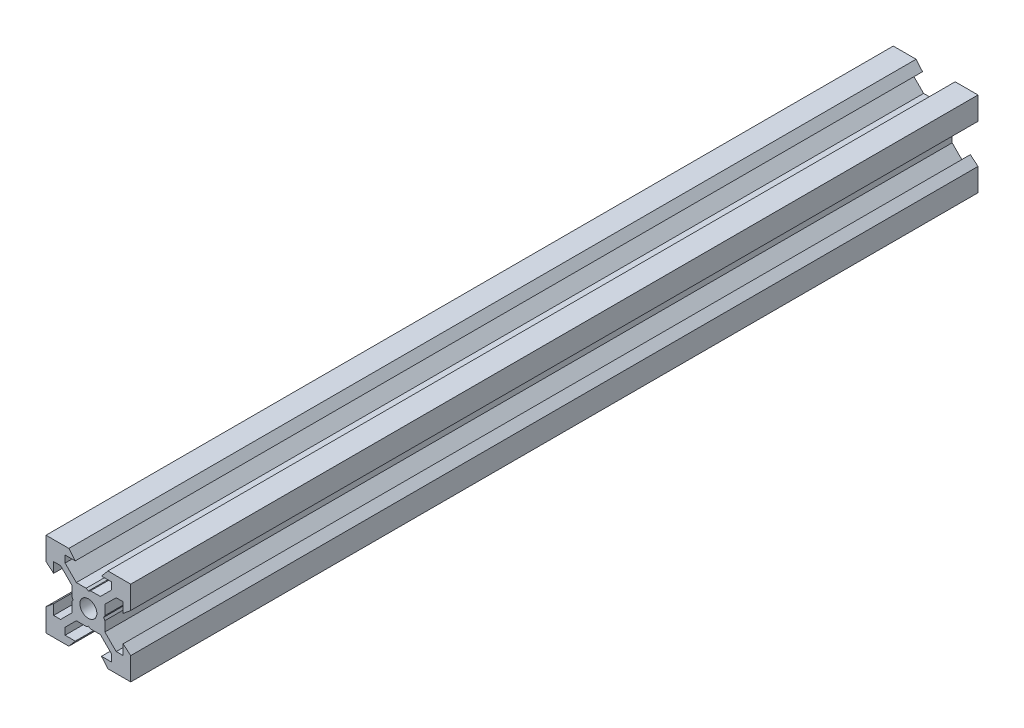
from build123d import *

# Parameters (mm, degrees)
SKETCH1_R           = 2
BOSS_EXTRUDE1_DEPTH = 100


with BuildPart() as part:
    # Sketch1 → Boss-Extrude1 (new, symmetric)
    with BuildSketch(Plane.XY):
        Polygon((10, 10), (10, 4.610379336), (8.2, 3.1), (8.2, 5.5), (6.560660172, 5.5), (3.9, 2.839339828), (3.9, 0.519615242), (3.6, 0), (3.9, -0.519615242), (3.9, -2.839339828), (6.560660172, -5.5), (8.2, -5.5), (8.2, -3.1), (10, -4.610379336), (10, -10), (4.610379336, -10), (3.1, -8.2), (5.5, -8.2), (5.5, -6.560660172), (2.839339828, -3.9), (0.519615242, -3.9), (0, -3.6), (-0.519615242, -3.9), (-2.839339828, -3.9), (-5.5, -6.560660172), (-5.5, -8.2), (-3.1, -8.2), (-4.610379336, -10), (-10, -10), (-10, -4.610379336), (-8.2, -3.1), (-8.2, -5.5), (-6.560660172, -5.5), (-3.9, -2.839339828), (-3.9, -0.519615242), (-3.6, 0), (-3.9, 0.519615242), (-3.9, 2.839339828), (-6.560660172, 5.5), (-8.2, 5.5), (-8.2, 3.1), (-10, 4.610379336), (-10, 10), (-4.610379336, 10), (-3.1, 8.2), (-5.5, 8.2), (-5.5, 6.560660172), (-2.839339828, 3.9), (-0.519615242, 3.9), (0, 3.6), (0.519615242, 3.9), (2.839339828, 3.9), (5.5, 6.560660172), (5.5, 8.2), (3.1, 8.2), (4.610379336, 10), align=None)
        Circle(SKETCH1_R, mode=Mode.SUBTRACT)
    extrude(amount=BOSS_EXTRUDE1_DEPTH, both=True)


solid = part.part
